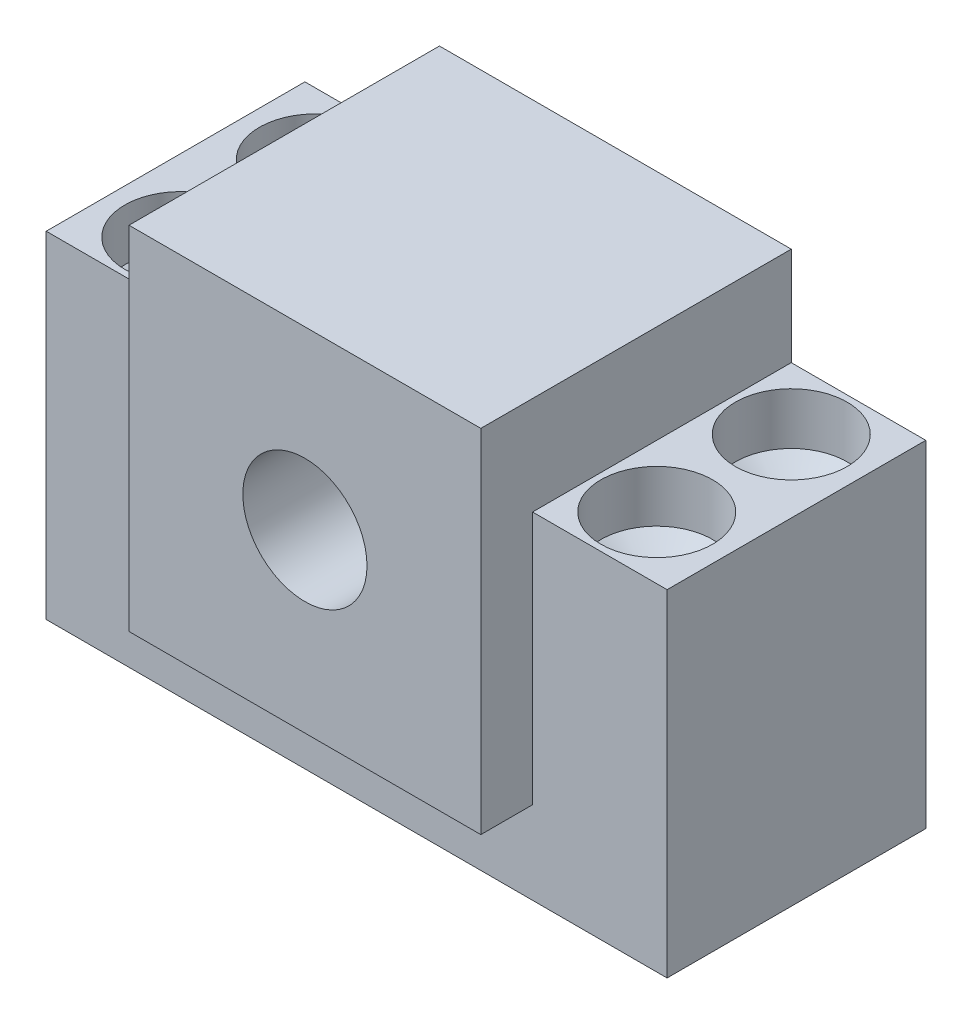
from build123d import *

# Parameters (mm, degrees)
BOSS_EXTRUDE1_DEPTH              = 25
SKETCH1_3_W                      = 34
SKETCH1_3_H                      = 34
BOSS_EXTRUDE2_DEPTH              = 30
F_6_6_6_6_DIAMETER_HOLE1_D       = 6.6
SKETCH4_R                        = 6
CUT_EXTRUDE1_DEPTH               = 30
F_10_8_10_8_DIAMETER_HOLE1_D     = 10.8
F_10_8_10_8_DIAMETER_HOLE1_DEPTH = 5
F_10_8_10_8_DIAMETER_HOLE1_TIP   = 3.244647343


with BuildPart() as part:
    # Sketch1 → Boss-Extrude1 (new body)
    with BuildSketch(Plane.XY):
        Polygon((-17, 16.25), (-30, 16.25), (-30, -16.25), (30, -16.25), (30, 16.25), (17, 16.25), (17, -8.25), (-17, -8.25), align=None)
    extrude(amount=BOSS_EXTRUDE1_DEPTH)

    # Sketch1<3> → Boss-Extrude2 (add)
    with BuildSketch(Plane.XY):
        with Locations((0, 8.75)):
            Rectangle(SKETCH1_3_W, SKETCH1_3_H)
    extrude(amount=BOSS_EXTRUDE2_DEPTH)

    # Ø6.6 (6.6) Diameter Hole1 (through all)
    with Locations(Plane(origin=(0, 16.25, 0), x_dir=(1, 0, 0), z_dir=(0, 1, 0))):
        with Locations((-23, -19), (-23, -6), (23, -6), (23, -19)):
            Hole(F_6_6_6_6_DIAMETER_HOLE1_D / 2)

    # Sketch4 → Cut-Extrude1 (cut)
    with BuildSketch(Plane.XY.offset(30)):
        with Locations((0, 8.75)):
            Circle(SKETCH4_R)
    extrude(amount=-CUT_EXTRUDE1_DEPTH, mode=Mode.SUBTRACT)

    # Ø10.8 (10.8) Diameter Hole1
    with Locations(Plane(origin=(0, 16.25, 0), x_dir=(1, 0, 0), z_dir=(0, 1, 0))):
        with Locations((-23, -19), (-23, -6), (23, -6), (23, -19)):
            Hole(F_10_8_10_8_DIAMETER_HOLE1_D / 2, depth=F_10_8_10_8_DIAMETER_HOLE1_DEPTH)
            with Locations((0, 0, -(F_10_8_10_8_DIAMETER_HOLE1_DEPTH + F_10_8_10_8_DIAMETER_HOLE1_TIP / 2))):  # 118° drill point
                Cone(0, F_10_8_10_8_DIAMETER_HOLE1_D / 2, F_10_8_10_8_DIAMETER_HOLE1_TIP, mode=Mode.SUBTRACT)


solid = part.part
